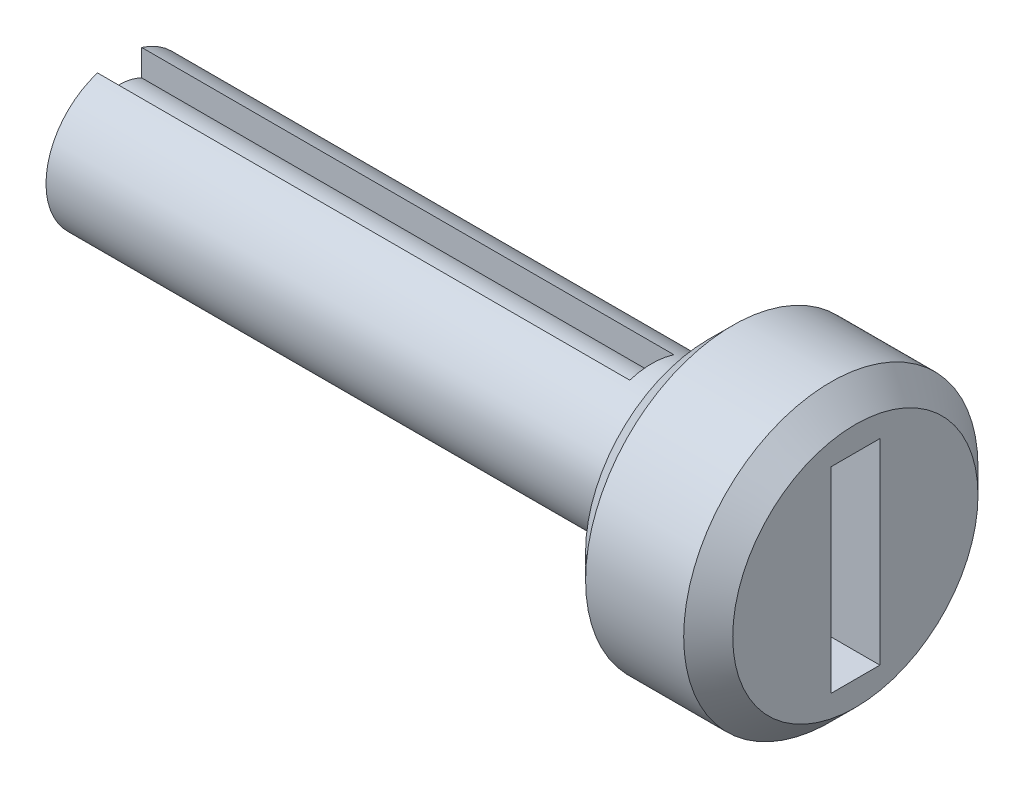
from build123d import *

# Parameters (mm, degrees)
SKETCH3_R          = 1.2
CUT_EXTRUDE1_DEPTH = 24
SKETCH4_W          = 2
SKETCH4_H          = 8
CUT_EXTRUDE2_DEPTH = 4
CHAMFER1_SIZE      = 1
CUT_EXTRUDE3_START = -21.7
CUT_EXTRUDE3_DEPTH = 21.7


with BuildPart() as part:
    # Sketch2 → Revolve1 (revolve)
    with BuildSketch(Plane(origin=(0, 0, 0), x_dir=(1, 0, 0), z_dir=(0, 1, 0)), mode=Mode.PRIVATE) as revolve1_sk:
        Polygon((0, 0), (0, 3), (24, 3), (24, 6), (30, 6), (30, 0), align=None)
    revolve(revolve1_sk.sketch.rotate(Axis((0, 0, 0), (1, 0, 0)), 180), axis=Axis((0, 0, 0), (1, 0, 0)))

    # Sketch3 → Cut-Extrude1 (cut)
    with BuildSketch(Plane.ZY):
        Circle(SKETCH3_R)
    extrude(amount=-CUT_EXTRUDE1_DEPTH, mode=Mode.SUBTRACT)

    # Sketch4 → Cut-Extrude2 (cut)
    with BuildSketch(Plane(origin=(30, 0, 0), x_dir=(0, 0, -1), z_dir=(1, 0, 0))):
        Rectangle(SKETCH4_W, SKETCH4_H)
    extrude(amount=-CUT_EXTRUDE2_DEPTH, mode=Mode.SUBTRACT)

    # Chamfer1
    chamfer1_edges = [part.edges().sort_by_distance(p)[0] for p in [
        (30, 0, -6),
        (24, 0, -6),
    ]]
    chamfer(chamfer1_edges, length=CHAMFER1_SIZE)

    # Sketch5 → Cut-Extrude3 (cut)
    with BuildSketch(Plane.ZY.offset(CUT_EXTRUDE3_START)):
        with BuildLine():
            Line((-0.9, 2.861817604), (-0.9, 1.78605711))
            ThreePointArc((-0.9, 1.78605711), (0, 2), (0.9, 1.78605711))
            Line((0.9, 1.78605711), (0.9, 2.861817604))
            ThreePointArc((0.9, 2.861817604), (0, 3), (-0.9, 2.861817604))
        make_face()
        with BuildLine():
            Line((-0.9, -1.78605711), (-0.9, -2.861817604))
            ThreePointArc((-0.9, -2.861817604), (0, -3), (0.9, -2.861817604))
            Line((0.9, -2.861817604), (0.9, -1.78605711))
            ThreePointArc((0.9, -1.78605711), (0, -2), (-0.9, -1.78605711))
        make_face()
    extrude(amount=CUT_EXTRUDE3_DEPTH, mode=Mode.SUBTRACT)


solid = part.part
